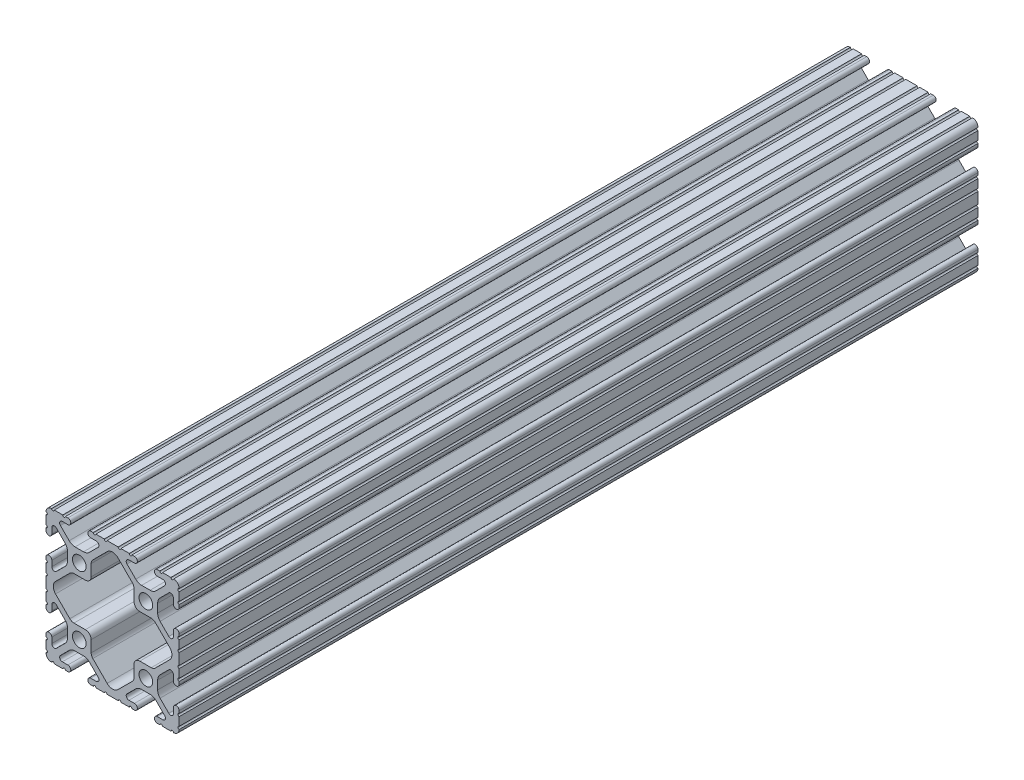
from build123d import *

# Parameters (mm, degrees)
BOSS_EXTRUDE1_DEPTH      = 152.4
BOSS_EXTRUDE1_DEPTH_BACK = 152.4
SKETCH3_R                = 2.6035
SKETCH4_R                = 0.508
CUT_EXTRUDE1_DEPTH       = 307.909367729
CIRPATTERN1_COUNT        = 4


with BuildPart() as part:
    # Sketch3 → Boss-Extrude1 (new, two sides: drawn at the far end of the back side and taken through both)
    with BuildSketch(Plane.XY.offset(-BOSS_EXTRUDE1_DEPTH_BACK)):
        with BuildLine():
            Line((-25.4, 0), (-25.4, 8.3439))
            ThreePointArc((-25.4, 8.3439), (-24.2951, 9.4488), (-23.1902, 8.3439))
            Line((-23.1902, 8.3439), (-23.1902, 6.225205544))
            ThreePointArc((-23.1902, 6.225205544), (-22.563006367, 5.286543939), (-21.45577951, 5.506785055))
            Line((-21.45577951, 5.506785055), (-18.12573597, 8.836828595))
            ThreePointArc((-18.12573597, 8.836828595), (-17.437482484, 9.866872728), (-17.1958, 11.081892626))
            Line((-17.1958, 11.081892626), (-17.1958, 14.318107374))
            ThreePointArc((-17.1958, 14.318107374), (-17.437482484, 15.533127272), (-18.12573597, 16.563171405))
            Line((-18.12573597, 16.563171405), (-21.45577951, 19.893214945))
            ThreePointArc((-21.45577951, 19.893214945), (-22.563006367, 20.113456061), (-23.1902, 19.174794456))
            Line((-23.1902, 19.174794456), (-23.1902, 17.0561))
            ThreePointArc((-23.1902, 17.0561), (-24.2951, 15.9512), (-25.4, 17.0561))
            Line((-25.4, 17.0561), (-25.4, 23.2918))
            ThreePointArc((-25.4, 23.2918), (-24.782522516, 24.782522516), (-23.2918, 25.4))
            Line((-23.2918, 25.4), (-17.0561, 25.4))
            ThreePointArc((-17.0561, 25.4), (-15.9512, 24.2951), (-17.0561, 23.1902))
            Line((-17.0561, 23.1902), (-19.174794456, 23.1902))
            ThreePointArc((-19.174794456, 23.1902), (-20.113456061, 22.563006367), (-19.893214945, 21.45577951))
            Line((-19.893214945, 21.45577951), (-16.563171405, 18.12573597))
            ThreePointArc((-16.563171405, 18.12573597), (-15.533127272, 17.437482484), (-14.318107374, 17.1958))
            Line((-14.318107374, 17.1958), (-11.081892626, 17.1958))
            ThreePointArc((-11.081892626, 17.1958), (-9.866872728, 17.437482484), (-8.836828595, 18.12573597))
            Line((-8.836828595, 18.12573597), (-5.506785055, 21.45577951))
            ThreePointArc((-5.506785055, 21.45577951), (-5.286543939, 22.563006367), (-6.225205544, 23.1902))
            Line((-6.225205544, 23.1902), (-8.3439, 23.1902))
            ThreePointArc((-8.3439, 23.1902), (-9.4488, 24.2951), (-8.3439, 25.4))
            Line((-8.3439, 25.4), (0, 25.4))
            Line((0, 25.4), (0, 22.627517619))
            ThreePointArc((0, 22.627517619), (-1.117818306, 22.405169734), (-2.065458908, 21.771976527))
            Line((-2.065458908, 21.771976527), (-7.533120897, 16.304314538))
            ThreePointArc((-7.533120897, 16.304314538), (-8.012145323, 15.587403822), (-8.180356332, 14.741749973))
            Line((-8.180356332, 14.741749973), (-8.180356332, 10.390156332))
            ThreePointArc((-8.180356332, 10.390156332), (-8.827591767, 8.827591767), (-10.390156332, 8.180356332))
            Line((-10.390156332, 8.180356332), (-14.741749973, 8.180356332))
            ThreePointArc((-14.741749973, 8.180356332), (-15.587403822, 8.012145323), (-16.304314538, 7.533120897))
            Line((-16.304314538, 7.533120897), (-21.771976527, 2.065458908))
            ThreePointArc((-21.771976527, 2.065458908), (-22.405169734, 1.117818306), (-22.627517619, 0))
            Line((-22.627517619, 0), (-25.4, 0))
        make_face()
        with Locations(Location((-12.7, 12.7, 0), (0, 0, 180))):
            Circle(SKETCH3_R, mode=Mode.SUBTRACT)
    extrude(amount=BOSS_EXTRUDE1_DEPTH + BOSS_EXTRUDE1_DEPTH_BACK)

    # Sketch4 → Cut-Extrude1 (cut, through all)
    with BuildSketch(Plane.XY.offset(152.4)):
        with Locations((-25.4, 2.6416)):
            Circle(SKETCH4_R)
        with Locations((-25.4, 6.8834)):
            Circle(SKETCH4_R)
        with Locations((-25.4, 18.5166)):
            Circle(SKETCH4_R)
        with Locations((-25.4, 22.7584)):
            Circle(SKETCH4_R)
        with Locations((-22.7584, 25.4)):
            Circle(SKETCH4_R)
        with Locations((-18.5166, 25.4)):
            Circle(SKETCH4_R)
        with Locations((-6.8834, 25.4)):
            Circle(SKETCH4_R)
        with Locations((-2.6416, 25.4)):
            Circle(SKETCH4_R)
    extrude(amount=-CUT_EXTRUDE1_DEPTH, mode=Mode.SUBTRACT)


with BuildPart() as cirpattern1_1:
    # CirPattern1: pattern copy
    add(part.part.rotate(Axis((0, 0, 0), (0, 0, 1)), 1 * 360 / CIRPATTERN1_COUNT))


with BuildPart() as cirpattern1_2:
    # CirPattern1: pattern copy
    add(part.part.rotate(Axis((0, 0, 0), (0, 0, 1)), 2 * 360 / CIRPATTERN1_COUNT))


with BuildPart() as cirpattern1_3:
    # CirPattern1: pattern copy
    add(part.part.rotate(Axis((0, 0, 0), (0, 0, 1)), 3 * 360 / CIRPATTERN1_COUNT))


with BuildPart() as part_1:
    add(part.part)

    # Combine1: union CirPattern1_1, CirPattern1_2, CirPattern1_3
    add(cirpattern1_1.part)
    add(cirpattern1_2.part)
    add(cirpattern1_3.part)


solid = part_1.part
